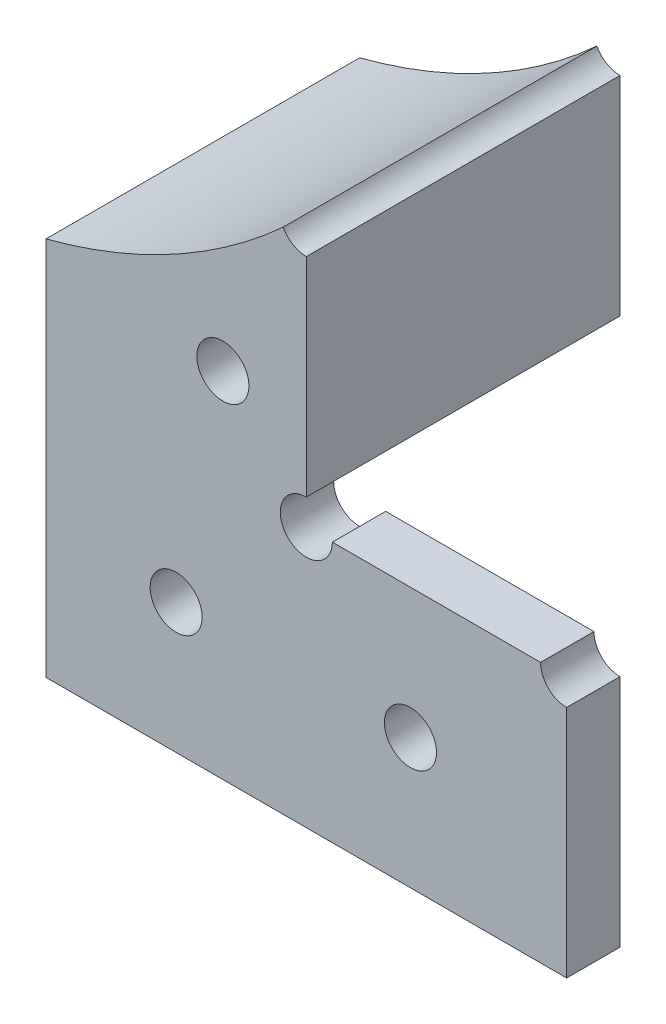
from build123d import *

# Parameters (mm, degrees)
SKETCH_1_W          = 20
SKETCH_1_H          = 20
SKETCH_1_R          = 2
EXTRUDE_1_DEPTH     = 4.1
SKETCH_2_W          = 20
SKETCH_2_H          = 20
EXTRUDE_2_DEPTH     = 24.1
CUT_EXTRUDE_1_DEPTH = 40.759401404
SKETCH_4_R          = 2
CUT_EXTRUDE_2_DEPTH = 40.759401404
SKETCH_5_W          = 4.1
SKETCH_5_H          = 20
EXTRUDE_3_DEPTH     = 20
SKETCH_7_R          = 2
CUT_EXTRUDE_3_DEPTH = 49.793544655


with BuildPart() as part:
    # 草图1 → 凸台-拉伸1 (new body)
    with BuildSketch(Plane.XY):
        Rectangle(SKETCH_1_W, SKETCH_1_H)
        Circle(SKETCH_1_R, mode=Mode.SUBTRACT)
    extrude(amount=EXTRUDE_1_DEPTH)

    # 草图2 → 凸台-拉伸2 (add)
    with BuildSketch(Plane.XY.offset(4.1)):
        with Locations((0, 20)):
            Rectangle(SKETCH_2_W, SKETCH_2_H)
    extrude(amount=-EXTRUDE_2_DEPTH)

    # 草图3 → 切除-拉伸1 (cut, through all)
    with BuildSketch(Plane.XY.offset(4.1)):
        with BuildLine():
            Line((-10, 30), (9.2059994, 30))
            ThreePointArc((9.2059994, 30), (0.308275872, 23.337476197), (-10, 19.178371007))
            Line((-10, 19.178371007), (-10, 30))
        make_face()
    extrude(amount=-CUT_EXTRUDE_1_DEPTH, mode=Mode.SUBTRACT)

    # 草图4 → 切除-拉伸2 (cut, through all)
    with BuildSketch(Plane.XY.offset(4.1)):
        with Locations((3.589185504, 17.178371007)):
            Circle(SKETCH_4_R)
    extrude(amount=-CUT_EXTRUDE_2_DEPTH, mode=Mode.SUBTRACT)

    # 草图5 → 凸台-拉伸3 (add)
    with BuildSketch(Plane(origin=(10, 0, 0), x_dir=(0, 0, -1), z_dir=(1, 0, 0))):
        with Locations((-2.05, 0)):
            Rectangle(SKETCH_5_W, SKETCH_5_H)
    extrude(amount=EXTRUDE_3_DEPTH)

    # 草图7 → 切除-拉伸3 (cut, through all)
    with BuildSketch(Plane.XY.offset(4.1)):
        with Locations((10, 10)):
            Circle(SKETCH_7_R)
        with Locations((10, 30)):
            Circle(SKETCH_7_R)
        with Locations((30, 10)):
            Circle(SKETCH_7_R)
        with Locations((18, 0)):
            Circle(SKETCH_7_R)
    extrude(amount=-CUT_EXTRUDE_3_DEPTH, mode=Mode.SUBTRACT)


solid = part.part
